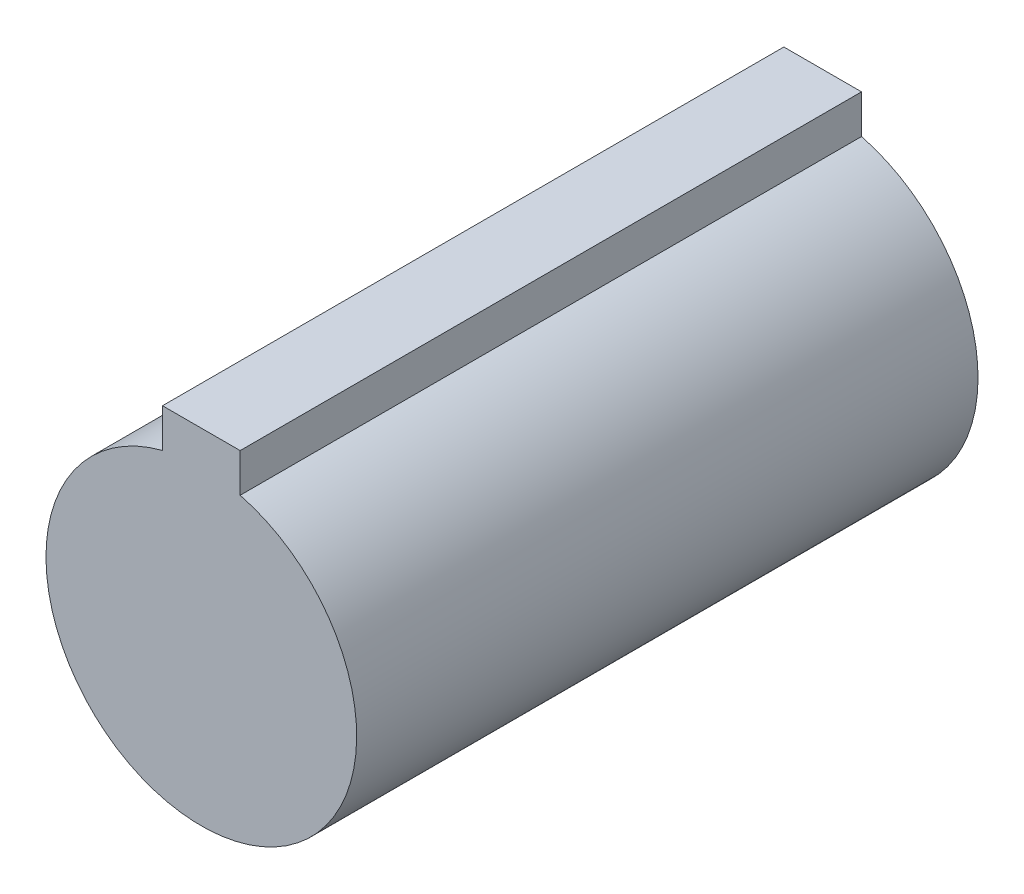
from build123d import *

# Parameters (mm, degrees)
SKETCH2_R           = 6.35
SKETCH2_W           = 3.175
SKETCH2_H           = 1.5875
BOSS_EXTRUDE2_DEPTH = 25.4


with BuildPart() as part:
    # Sketch2 → Boss-Extrude2 (new body)
    with BuildSketch(Plane.XY.offset(25.4)):
        with Locations((-1.805950464, 2.531657465)):
            Circle(SKETCH2_R)
        with Locations((-1.805950464, 9.469443562)):
            Rectangle(SKETCH2_W, SKETCH2_H)
    extrude(amount=BOSS_EXTRUDE2_DEPTH)


solid = part.part
